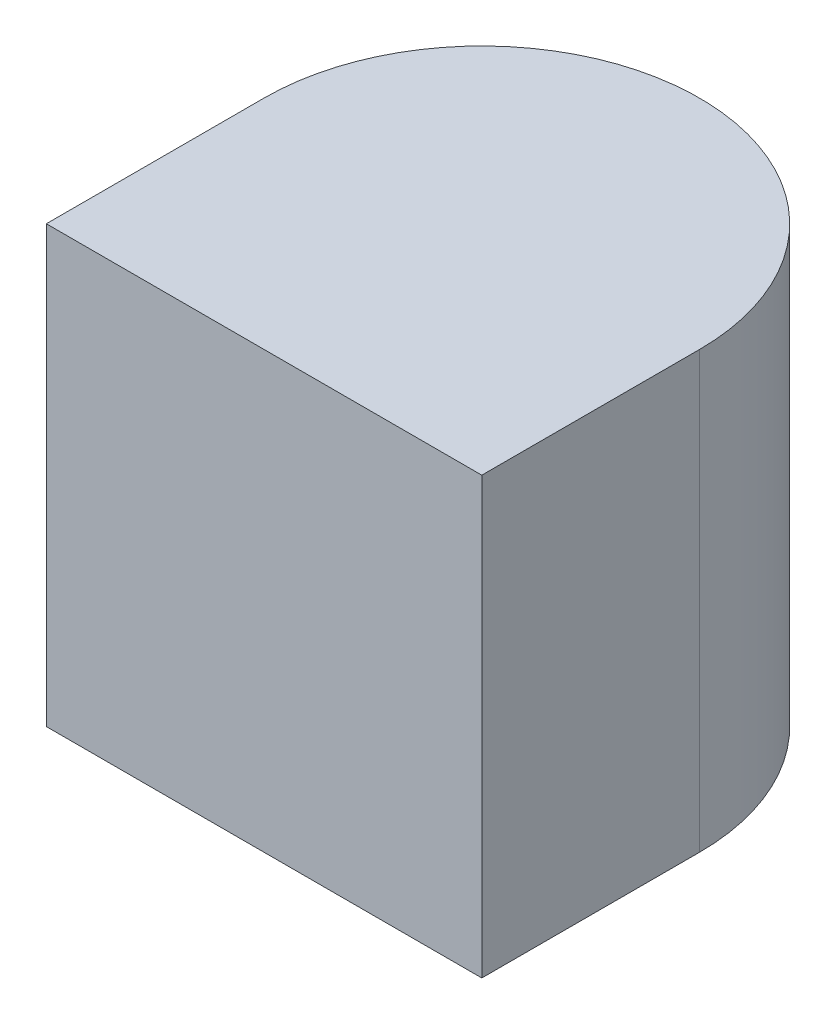
from build123d import *

# Parameters (mm, degrees)
BOSS_EXTRUDE1_DEPTH = 20


with BuildPart() as part:
    # Sketch1 → Boss-Extrude1 (new body)
    with BuildSketch(Plane(origin=(0, 0, 0), x_dir=(1, 0, 0), z_dir=(0, 1, 0))):
        with BuildLine():
            Line((-10, -20), (10, -20))
            Line((10, -20), (10, -10))
            ThreePointArc((10, -10), (0, 0), (-10, -10))
            Line((-10, -10), (-10, -20))
        make_face()
    extrude(amount=BOSS_EXTRUDE1_DEPTH)


solid = part.part
